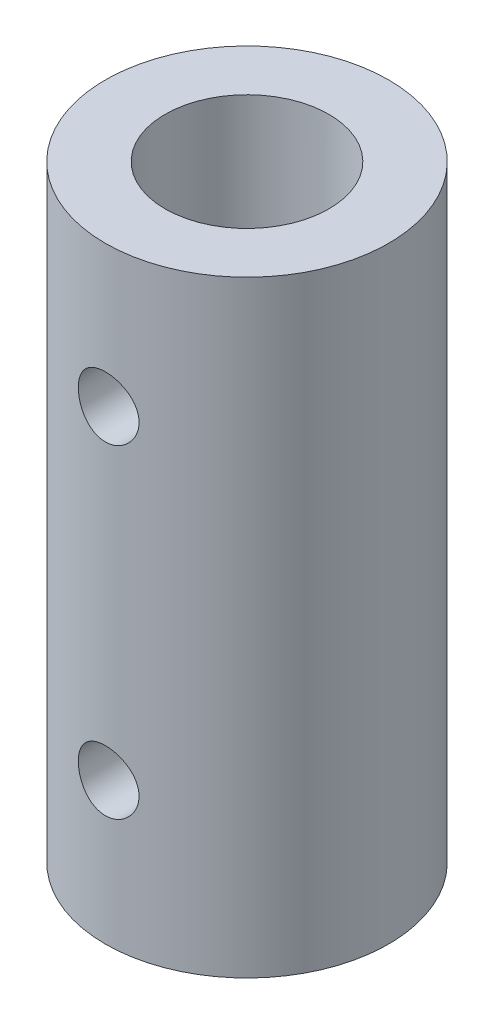
from build123d import *

# Parameters (mm, degrees)
SKETCH1_R               = 7
SKETCH1_R_2             = 4.05
BOSS_EXTRUDE1_DEPTH     = 15
BOSS_EXTRUDE2_START     = -15
SKETCH1_3_R             = 7
SKETCH1_3_R_2           = 2.55
BOSS_EXTRUDE2_DEPTH     = 15
CUT_EXTRUDE1_DEPTH      = 18.972200756
CUT_EXTRUDE1_DEPTH_BACK = 18.972200756
SKETCH2_R               = 1.5


with BuildPart() as part:
    # Sketch1 → Boss-Extrude1 (new body)
    with BuildSketch(Plane(origin=(0, 0, 0), x_dir=(1, 0, 0), z_dir=(0, 1, 0))):
        Circle(SKETCH1_R)
        Circle(SKETCH1_R_2, mode=Mode.SUBTRACT)
    extrude(amount=BOSS_EXTRUDE1_DEPTH)

    # Sketch1<3> → Boss-Extrude2 (add)
    with BuildSketch(Plane(origin=(0, 0, 0), x_dir=(1, 0, 0), z_dir=(0, 1, 0)).offset(BOSS_EXTRUDE2_START)):
        Circle(SKETCH1_3_R)
        Circle(SKETCH1_3_R_2, mode=Mode.SUBTRACT)
    extrude(amount=BOSS_EXTRUDE2_DEPTH)

    # Sketch2 → Cut-Extrude1 (cut, two sides: drawn at the far end of the back side and taken through both)
    with BuildSketch(Plane.XY.offset(-CUT_EXTRUDE1_DEPTH_BACK)):
        with Locations((0, 8)):
            Circle(SKETCH2_R)
        with Locations((0, -8)):
            Circle(SKETCH2_R)
    extrude(amount=CUT_EXTRUDE1_DEPTH + CUT_EXTRUDE1_DEPTH_BACK, mode=Mode.SUBTRACT)


solid = part.part
